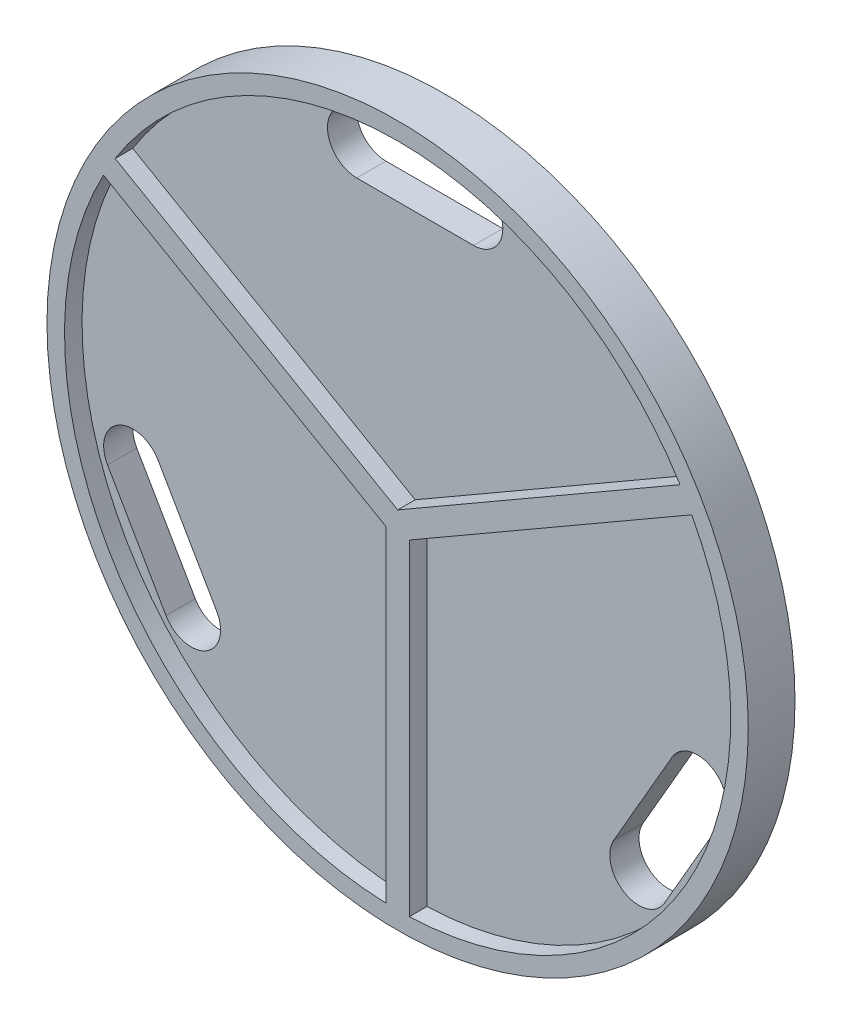
from build123d import *

# Parameters (mm, degrees)
SKETCH_1_R      = 60
EXTRUDE_1_DEPTH = 5
SKETCH_2_R      = 60
SKETCH_2_R_2    = 57
EXTRUDE_2_DEPTH = 3
EXTRUDE_3_DEPTH = 3


with BuildPart() as part:
    # 草图1 → 凸台-拉伸1 (new body)
    with BuildSketch(Plane.XY):
        Circle(SKETCH_1_R)
        with BuildLine():
            Line((-43.97114317, -13.839745962), (-33.97114317, -31.160254038))
            ThreePointArc((-33.97114317, -31.160254038), (-35.801270189, -37.990381057), (-42.631397208, -36.160254038))
            Line((-42.631397208, -36.160254038), (-52.631397208, -18.839745962))
            ThreePointArc((-52.631397208, -18.839745962), (-50.801270189, -12.009618943), (-43.97114317, -13.839745962))
        make_face(mode=Mode.SUBTRACT)
        with BuildLine():
            Line((43.97114317, -13.839745962), (33.97114317, -31.160254038))
            ThreePointArc((33.97114317, -31.160254038), (35.801270189, -37.990381057), (42.631397208, -36.160254038))
            Line((42.631397208, -36.160254038), (52.631397208, -18.839745962))
            ThreePointArc((52.631397208, -18.839745962), (50.801270189, -12.009618943), (43.97114317, -13.839745962))
        make_face(mode=Mode.SUBTRACT)
        with BuildLine():
            Line((10, 45), (-10, 45))
            ThreePointArc((-10, 45), (-15, 50), (-10, 55))
            Line((-10, 55), (10, 55))
            ThreePointArc((10, 55), (15, 50), (10, 45))
        make_face(mode=Mode.SUBTRACT)
    extrude(amount=EXTRUDE_1_DEPTH)

    # 草图2 → 凸台-拉伸2 (add)
    with BuildSketch(Plane.XY.offset(5)):
        Circle(SKETCH_2_R)
        Circle(SKETCH_2_R_2, mode=Mode.SUBTRACT)
    extrude(amount=EXTRUDE_2_DEPTH)

    # 草图3 → 凸台-拉伸3 (add)
    with BuildSketch(Plane.XY.offset(5)):
        with BuildLine():
            Line((48.333051801, 30.214501545), (0, 2.309401077))
            Line((0, 2.309401077), (-48.333051801, 30.214501545))
            ThreePointArc((-48.333051801, 30.214501545), (-49.363448016, 28.5), (-50.333051801, 26.75039993))
            Line((-50.333051801, 26.75039993), (-2, -1.154700538))
            Line((-2, -1.154700538), (-2, -56.964901475))
            ThreePointArc((-2, -56.964901475), (0, -57), (2, -56.964901475))
            Line((2, -56.964901475), (2, -1.154700538))
            Line((2, -1.154700538), (50.333051801, 26.75039993))
            ThreePointArc((50.333051801, 26.75039993), (49.363448016, 28.5), (48.333051801, 30.214501545))
        make_face()
    extrude(amount=EXTRUDE_3_DEPTH)


solid = part.part
